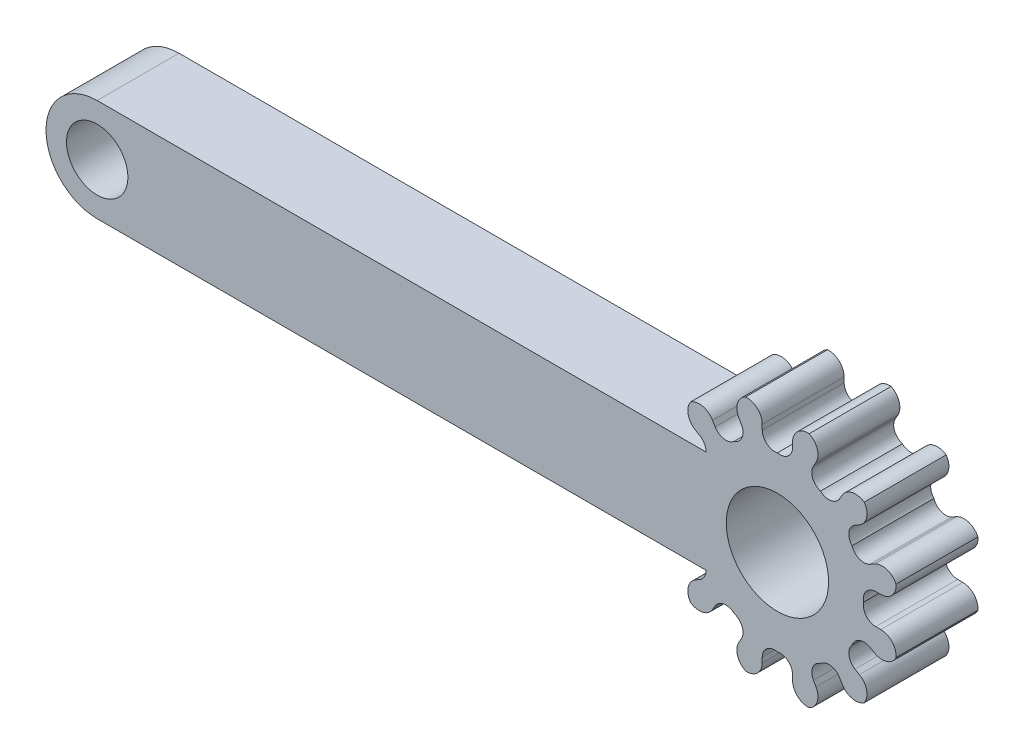
from build123d import *

# Parameters (mm, degrees)
SKETCH1_R           = 1.5
BOSS_EXTRUDE1_DEPTH = 4
CUT_EXTRUDE1_DEPTH  = 23.415528994
CIRPATTERN1_COUNT   = 12
SKETCH3_W           = 11.336678395
SKETCH3_H           = 5
BOSS_EXTRUDE2_DEPTH = 4
SKETCH4_R           = 2.5
CUT_EXTRUDE2_DEPTH  = 23.170725743


with BuildPart() as part:
    # Sketch1 → Boss-Extrude1 (new body)
    with BuildSketch(Plane.XY):
        with BuildLine():
            Line((-18, 2.5), (9.769591268, 2.5))
            ThreePointArc((9.769591268, 2.5), (21.223947325, 0), (9.769591268, -2.5))
            Line((9.769591268, -2.5), (-18, -2.5))
            ThreePointArc((-18, -2.5), (-20.5, 0), (-18, 2.5))
        make_face()
        with Locations((-18, 0)):
            Circle(SKETCH1_R, mode=Mode.SUBTRACT)
    extrude(amount=BOSS_EXTRUDE1_DEPTH)

    # Sketch2 → Cut-Extrude1 (cut, through all)
    with BuildSketch(Plane.XY.offset(4)):
        with BuildLine():
            Line((17.107572926, 4.746445804), (16.983821507, 4.529223369))
            ThreePointArc((16.983821507, 4.529223369), (16.945677893, 4.005263167), (17.328947325, 3.64596695))
            ThreePointArc((17.328947325, 3.64596695), (17.831741692, 3.493693994), (18.266432731, 3.788707433))
            Line((18.266432731, 3.788707433), (18.392677169, 4.004490523))
            ThreePointArc((18.392677169, 4.004490523), (18.877651327, 4.357969149), (19.466588012, 4.242640687))
            ThreePointArc((19.466588012, 4.242640687), (18.501167967, 5.676312659), (16.776861596, 5.795554958))
            ThreePointArc((16.776861596, 5.795554958), (17.171207316, 5.343185058), (17.107572926, 4.746445804))
        make_face()
    cut_extrude1 = extrude(amount=-CUT_EXTRUDE1_DEPTH, mode=Mode.SUBTRACT)

    # CirPattern1: Cut-Extrude1 ×12 about axis
    cirpattern1_axis = Axis((15.223947325, 0, 0), (0, 0, 1))
    for i in range(1, CIRPATTERN1_COUNT):
        add(cut_extrude1.rotate(cirpattern1_axis, i * 360 / CIRPATTERN1_COUNT), mode=Mode.SUBTRACT)

    # Sketch3 → Boss-Extrude2 (add)
    with BuildSketch(Plane.XY.offset(4)):
        with Locations((11.656973093, 0)):
            Rectangle(SKETCH3_W, SKETCH3_H)
    extrude(amount=-BOSS_EXTRUDE2_DEPTH)

    # Sketch4 → Cut-Extrude2 (cut, through all)
    with BuildSketch(Plane.XY.offset(4)):
        with Locations((15.223947325, 0)):
            Circle(SKETCH4_R)
    extrude(amount=-CUT_EXTRUDE2_DEPTH, mode=Mode.SUBTRACT)


solid = part.part
